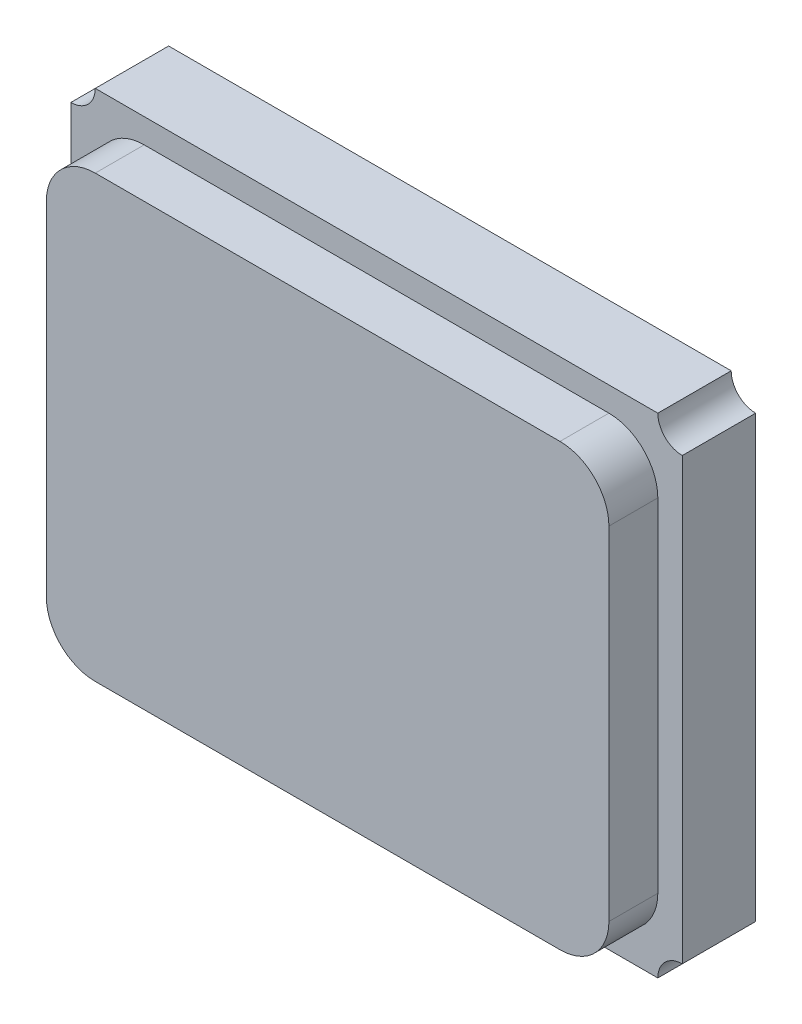
from build123d import *

# Parameters (mm, degrees)
SEMELLE_DEPTH   = 0.3
COUVERCLE_DEPTH = 0.2


with BuildPart() as part:
    # Esquisse1 → semelle (new body)
    with BuildSketch(Plane.XY):
        with BuildLine():
            Line((-1.25, -0.9), (-1.25, 0.9))
            ThreePointArc((-1.25, 0.9), (-1.179289322, 0.929289322), (-1.15, 1))
            Line((-1.15, 1), (1.15, 1))
            ThreePointArc((1.15, 1), (1.179289322, 0.929289322), (1.25, 0.9))
            Line((1.25, 0.9), (1.25, -0.9))
            ThreePointArc((1.25, -0.9), (1.179289322, -0.929289322), (1.15, -1))
            Line((1.15, -1), (-1.15, -1))
            ThreePointArc((-1.15, -1), (-1.179289322, -0.929289322), (-1.25, -0.9))
        make_face()
    extrude(amount=SEMELLE_DEPTH)

    # Esquisse2 → couvercle (add)
    with BuildSketch(Plane.XY.offset(0.3)):
        with BuildLine():
            Line((-0.95, 0.9), (0.95, 0.9))
            ThreePointArc((0.95, 0.9), (1.091421356, 0.841421356), (1.15, 0.7))
            Line((1.15, 0.7), (1.15, -0.7))
            ThreePointArc((1.15, -0.7), (1.091421356, -0.841421356), (0.95, -0.9))
            Line((0.95, -0.9), (-0.95, -0.9))
            ThreePointArc((-0.95, -0.9), (-1.091421356, -0.841421356), (-1.15, -0.7))
            Line((-1.15, -0.7), (-1.15, 0.7))
            ThreePointArc((-1.15, 0.7), (-1.091421356, 0.841421356), (-0.95, 0.9))
        make_face()
    extrude(amount=COUVERCLE_DEPTH)


solid = part.part
